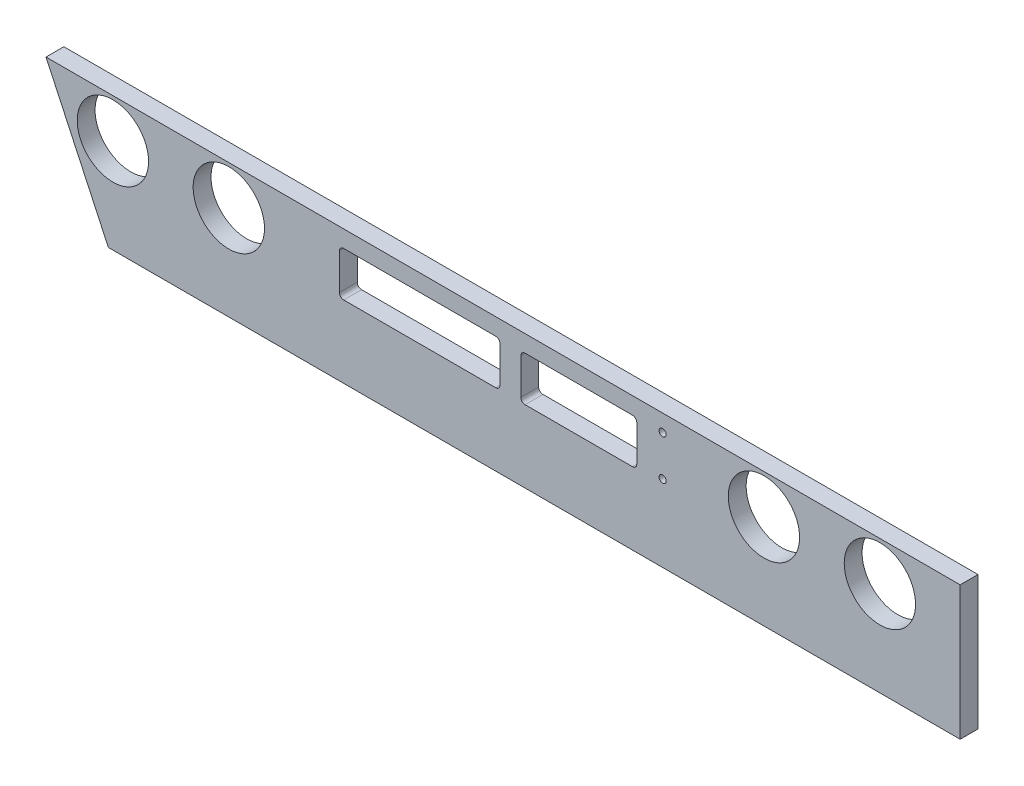
from build123d import *

# Parameters (mm, degrees)
SKETCH1_W          = 330.2
SKETCH1_H          = 47.625
SKETCH1_R          = 12.7
SKETCH1_R_2        = 1.27
EXTRUDE1_DEPTH     = 6.35
CUT_EXTRUDE1_DEPTH = 167.929229484


with BuildPart() as part:
    # Sketch1 → Extrude1 (new body)
    with BuildSketch(Plane.XY):
        Rectangle(SKETCH1_W, SKETCH1_H)
        with Locations((-136.525, 9.8425)):
            Circle(SKETCH1_R, mode=Mode.SUBTRACT)
        with Locations((-95.25, 9.8425)):
            Circle(SKETCH1_R, mode=Mode.SUBTRACT)
        with Locations(Location((95.25, 9.8425, 0), (0, 0, 180))):
            Circle(SKETCH1_R, mode=Mode.SUBTRACT)
        with Locations(Location((136.525, 9.8425, 0), (0, 0, 180))):
            Circle(SKETCH1_R, mode=Mode.SUBTRACT)
        with Locations((59.182, 17.7673)):
            Circle(SKETCH1_R_2, mode=Mode.SUBTRACT)
        with Locations((59.182, 3.4671)):
            Circle(SKETCH1_R_2, mode=Mode.SUBTRACT)
        with BuildLine():
            Line((-54.356, 17.78), (-0.254, 17.78))
            ThreePointArc((-0.254, 17.78), (0.823630735, 17.333630735), (1.27, 16.256))
            Line((1.27, 16.256), (1.27, 3.429))
            ThreePointArc((1.27, 3.429), (0.823630735, 2.351369265), (-0.254, 1.905))
            Line((-0.254, 1.905), (-54.356, 1.905))
            ThreePointArc((-54.356, 1.905), (-55.433630735, 2.351369265), (-55.88, 3.429))
            Line((-55.88, 3.429), (-55.88, 16.256))
            ThreePointArc((-55.88, 16.256), (-55.433630735, 17.333630735), (-54.356, 17.78))
        make_face(mode=Mode.SUBTRACT)
        with BuildLine():
            Line((10.2235, 17.78), (48.4505, 17.78))
            ThreePointArc((48.4505, 17.78), (49.528130735, 17.333630735), (49.9745, 16.256))
            Line((49.9745, 16.256), (49.9745, 3.429))
            ThreePointArc((49.9745, 3.429), (49.528130735, 2.351369265), (48.4505, 1.905))
            Line((48.4505, 1.905), (10.2235, 1.905))
            ThreePointArc((10.2235, 1.905), (9.145869265, 2.351369265), (8.6995, 3.429))
            Line((8.6995, 3.429), (8.6995, 16.256))
            ThreePointArc((8.6995, 16.256), (9.145869265, 17.333630735), (10.2235, 17.78))
        make_face(mode=Mode.SUBTRACT)
    extrude(amount=EXTRUDE1_DEPTH)

    # Sketch2 → Cut-Extrude1 (cut, through all)
    with BuildSketch(Plane.XY):
        Polygon((-167.77348356, 39.759180653), (-167.77348356, -38.14883308), (-131.444750208, -38.14883308), align=None)
    extrude(amount=CUT_EXTRUDE1_DEPTH, mode=Mode.SUBTRACT)


solid = part.part
